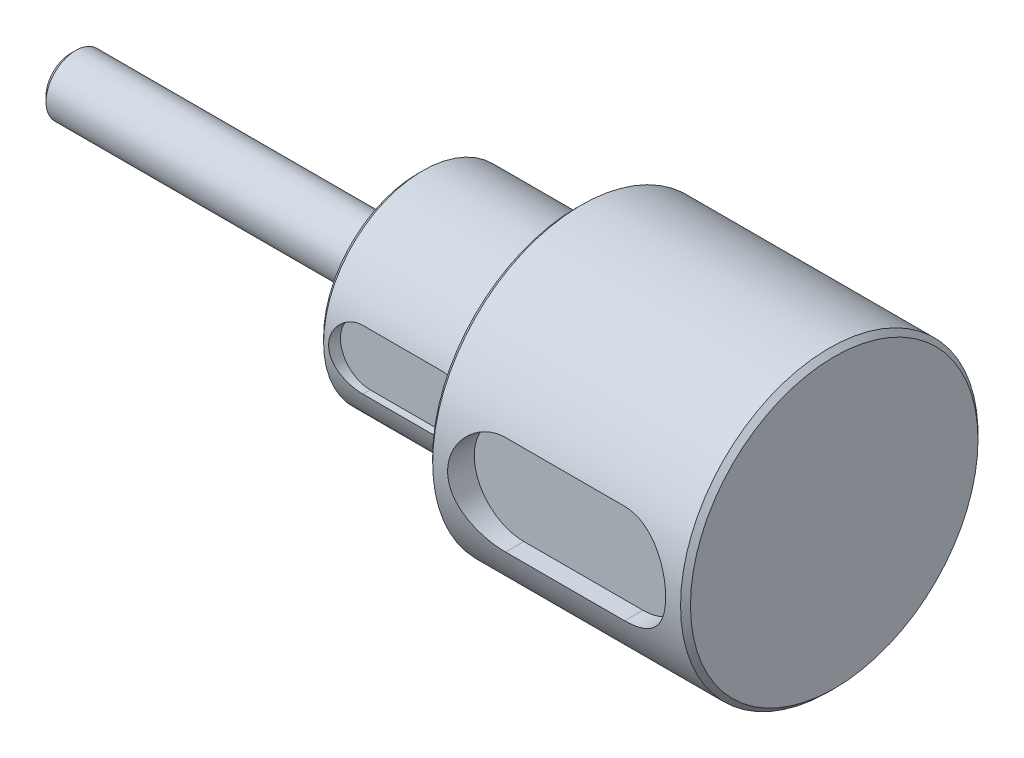
from build123d import *

# Parameters (mm, degrees)
CUT_EXTRUDE_1_DEPTH = 1.2
CUT_EXTRUDE_2_DEPTH = 2.7


with BuildPart() as part:
    # Эскиз1 → Повернуть1 (revolve)
    with BuildSketch(Plane.XY):
        with BuildLine():
            Line((0, 0), (0, 2.5))
            Line((0, 2.5), (0.5, 3))
            Line((0.5, 3), (34.5, 3))
            ThreePointArc((34.5, 3), (34.853553391, 3.146446609), (35, 3.5))
            Line((35, 3.5), (35, 9.5))
            Line((35, 9.5), (35.5, 10))
            Line((35.5, 10), (50.5, 10))
            ThreePointArc((50.5, 10), (50.853553391, 10.146446609), (51, 10.5))
            Line((51, 10.5), (51, 14.5))
            Line((51, 14.5), (51.5, 15))
            Line((51.5, 15), (76.5, 15))
            Line((76.5, 15), (77, 14.5))
            Line((77, 14.5), (77, 0))
            Line((77, 0), (0, 0))
        make_face()
    revolve(axis=Axis((0, 0, 0), (1, 0, 0)))

    # Эскиз3 → Вырез-Вытянуть1 (cut)
    with BuildSketch(Plane.XY.offset(10)):
        with BuildLine():
            Line((39, 3), (47, 3))
            ThreePointArc((47, 3), (50, 0), (47, -3))
            Line((47, -3), (39, -3))
            ThreePointArc((39, -3), (36, 0), (39, 3))
        make_face()
    extrude(amount=-CUT_EXTRUDE_1_DEPTH, mode=Mode.SUBTRACT)

    # Эскиз4 → Вырез-Вытянуть2 (cut)
    with BuildSketch(Plane.XY.offset(15)):
        with BuildLine():
            Line((58, 5), (70, 5))
            ThreePointArc((70, 5), (75, 0), (70, -5))
            Line((70, -5), (58, -5))
            ThreePointArc((58, -5), (53, 0), (58, 5))
        make_face()
    extrude(amount=-CUT_EXTRUDE_2_DEPTH, mode=Mode.SUBTRACT)


solid = part.part
